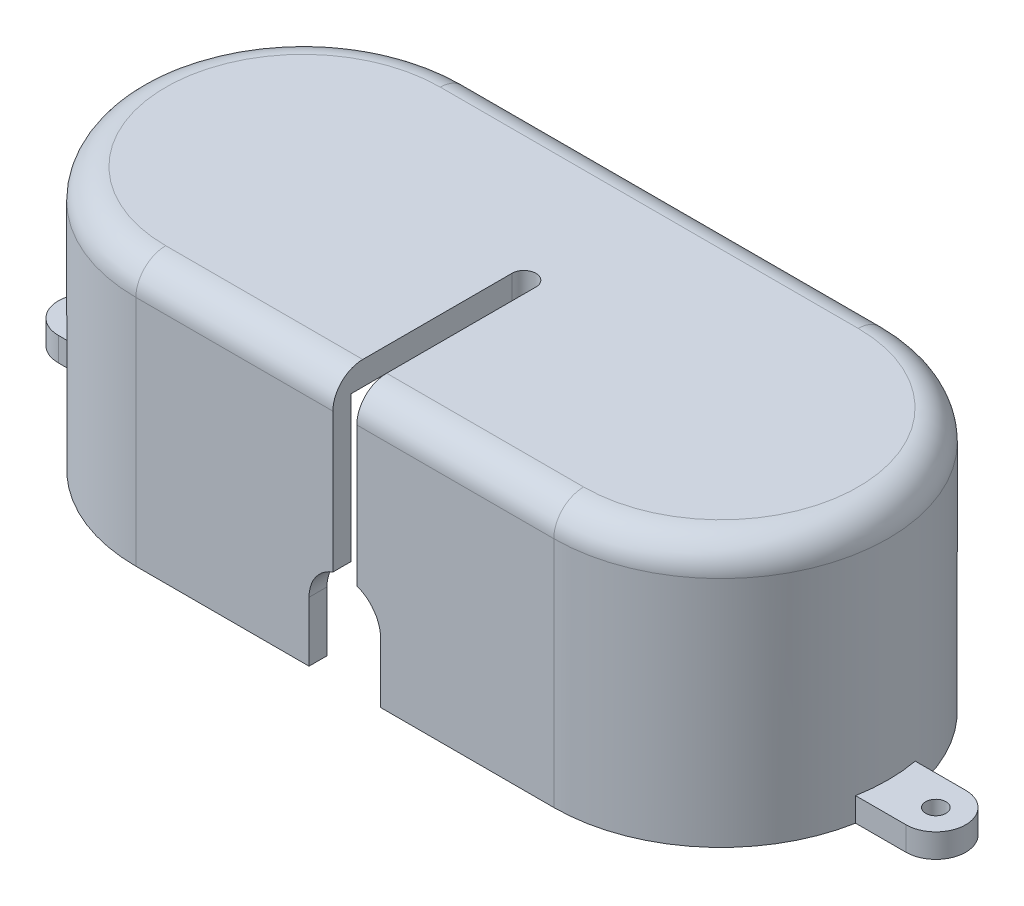
from build123d import *

# Parameters (mm, degrees)
BOSS_EXTRUDE1_DEPTH = 40
BOSS_EXTRUDE2_START = 40
BOSS_EXTRUDE2_DEPTH = 4
SKETCH3_R           = 1.7
BOSS_EXTRUDE3_DEPTH = 4
CUT_EXTRUDE1_DEPTH  = 4
SKETCH5_W           = 4
SKETCH5_H           = 44
CUT_EXTRUDE2_DEPTH  = 30
SKETCH6_R           = 2
CUT_EXTRUDE3_DEPTH  = 93.173748974
FILLET1_R           = 5


with BuildPart() as part:
    # Sketch1 → Boss-Extrude1 (new body)
    with BuildSketch(Plane(origin=(0, 0, 0), x_dir=(1, 0, 0), z_dir=(0, 1, 0))):
        with BuildLine():
            Line((-35, 28), (35, 28))
            ThreePointArc((35, 28), (63, 0), (35, -28))
            Line((35, -28), (-35, -28))
            ThreePointArc((-35, -28), (-63, 0), (-35, 28))
        make_face()
        with BuildLine():
            Line((-35, 25), (35, 25))
            ThreePointArc((35, 25), (60, 0), (35, -25))
            Line((35, -25), (-35, -25))
            ThreePointArc((-35, -25), (-60, 0), (-35, 25))
        make_face(mode=Mode.SUBTRACT)
    extrude(amount=BOSS_EXTRUDE1_DEPTH)

    # Sketch1<2> → Boss-Extrude2 (add)
    with BuildSketch(Plane(origin=(0, 0, 0), x_dir=(1, 0, 0), z_dir=(0, 1, 0)).offset(BOSS_EXTRUDE2_START)):
        with BuildLine():
            Line((-35, 28), (35, 28))
            ThreePointArc((35, 28), (63, 0), (35, -28))
            Line((35, -28), (-35, -28))
            ThreePointArc((-35, -28), (-63, 0), (-35, 28))
        make_face()
    extrude(amount=BOSS_EXTRUDE2_DEPTH)

    # Sketch3 → Boss-Extrude3 (add)
    with BuildSketch(Plane.XZ):
        with BuildLine():
            Line((-62.549954628, 5), (-71, 5))
            ThreePointArc((-71, 5), (-76, 0), (-71, -5))
            Line((-71, -5), (-62.549954628, -5))
            ThreePointArc((-62.549954628, -5), (-63, 0), (-62.549954628, 5))
        make_face()
        with Locations(Location((-71, 0, 0), (0, 0, 270))):
            Circle(SKETCH3_R, mode=Mode.SUBTRACT)
    boss_extrude3 = extrude(amount=-BOSS_EXTRUDE3_DEPTH)

    # Mirror1: Boss-Extrude3 across plane
    add(boss_extrude3.mirror(Plane(origin=(0, 0, 0), x_dir=(0, 0, 1), z_dir=(1, 0, 0))))

    # Sketch4 → Cut-Extrude1 (cut)
    with BuildSketch(Plane(origin=(0, 0, 25), x_dir=(-1, 0, 0), z_dir=(0, 0, -1))):
        with BuildLine():
            Line((6, 10), (6, 0))
            Line((6, 0), (-6, 0))
            Line((-6, 0), (-6, 10))
            ThreePointArc((-6, 10), (0, 16), (6, 10))
        make_face()
    extrude(amount=-CUT_EXTRUDE1_DEPTH, mode=Mode.SUBTRACT)

    # Sketch5 → Cut-Extrude2 (cut)
    with BuildSketch(Plane.XY.offset(28)):
        with Locations((0, 22)):
            Rectangle(SKETCH5_W, SKETCH5_H)
    extrude(amount=-CUT_EXTRUDE2_DEPTH, mode=Mode.SUBTRACT)

    # Sketch6 → Cut-Extrude3 (cut, through all)
    with BuildSketch(Plane(origin=(0, 44, 0), x_dir=(1, 0, 0), z_dir=(0, 1, 0))):
        with Locations((0, 2)):
            Circle(SKETCH6_R)
    extrude(amount=-CUT_EXTRUDE3_DEPTH, mode=Mode.SUBTRACT)

    # Fillet1
    fillet1_edges = [part.edges().sort_by_distance(p)[0] for p in [
        (18.5, 44, 28),
        (-63, 44, 0),
        (0, 44, -28),
        (63, 44, 0),
    ]]
    fillet(fillet1_edges, radius=FILLET1_R)


solid = part.part
